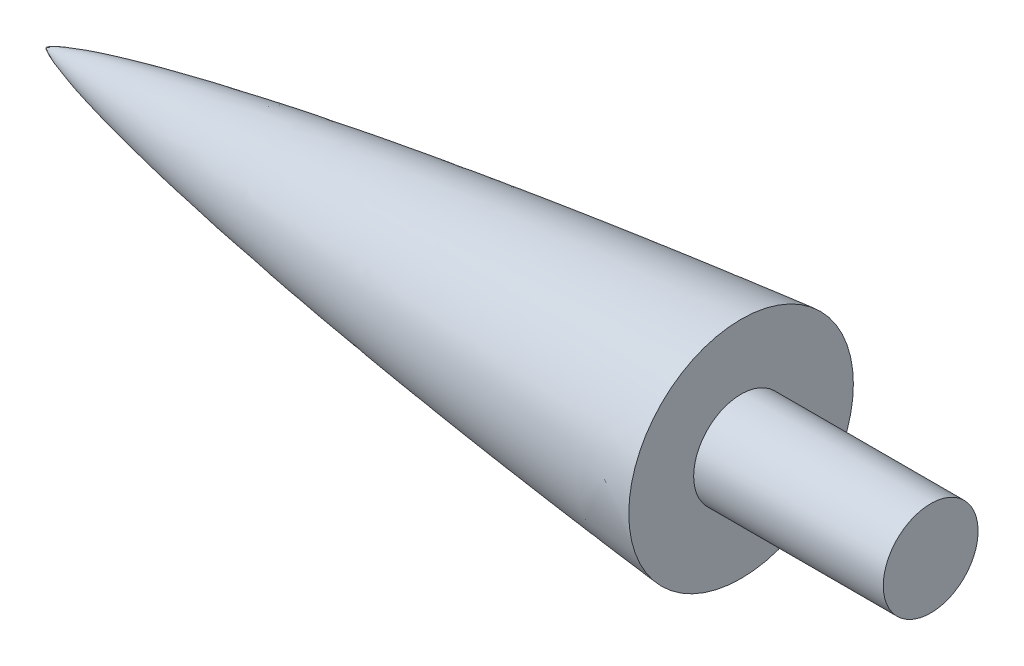
from build123d import *


with BuildPart() as part:
    # Sketch1 → Revolve1 (revolve)
    with BuildSketch(Plane(origin=(0, 0, 0), x_dir=(1, 0, 0), z_dir=(0, 1, 0)), mode=Mode.PRIVATE) as revolve1_sk:
        with BuildLine():
            Line((0, 0), (237, 0))
            Line((237, 0), (237, 12.7))
            Line((237, 12.7), (186.200000001, 12.7))
            Line((186.200000001, 12.7), (186.200000001, 30.088313688))
            add(Edge.make_bspline(
                [(0, 0), (0.003158286, 0.008829813), (0.011229963, 0.025572562), (0.034173952, 0.055394335), (0.070730621, 0.094265852), (0.115237936, 0.13487999), (0.179553821, 0.187856384), (0.267185048, 0.253150012), (0.397734037, 0.341277271), (0.610871439, 0.471010948), (0.957250279, 0.66022061), (1.547122185, 0.947112728), (2.583385336, 1.392008475), (4.426346664, 2.084223597), (7.618568962, 3.126254483), (13.126991419, 4.685853354), (21.464841311, 6.726340541), (32.249527339, 9.038765252), (44.876919941, 11.458172514), (58.254624304, 13.792618458), (69.984213357, 15.685468886), (80.05309686, 17.220485599), (90.128985738, 18.692959915), (100.2174998, 20.108027689), (110.306660177, 21.456906321), (120.416788561, 22.748698481), (128.82775593, 23.787076006), (134.748260742, 24.498780815), (139.767576372, 25.090713467), (144.890346289, 25.683106453), (149.822499028, 26.247006409), (155.957915428, 26.929045801), (162.350717259, 27.629141752), (169.646330146, 28.401245318), (175.523614971, 29.015904278), (181.666346717, 29.636473719), (184.662971425, 29.936018172), (186.200000001, 30.088313688)],
                knots=[0, 0, 0, 0, 0, 0.000179647, 0.000359294, 0.000718589, 0.001028237, 0.001337886, 0.001963562, 0.002821582, 0.004059812, 0.006140202, 0.009559921, 0.015445992, 0.02576483, 0.044031029, 0.074194495, 0.125644126, 0.19100416, 0.256364194, 0.321724227, 0.387084262, 0.41976428, 0.452444297, 0.517804332, 0.583164367, 0.615844384, 0.648524402, 0.681204419, 0.697544428, 0.713884437, 0.746564454, 0.779244471, 0.811924489, 0.844604506, 0.877284523, 0.909964541, 0.909964541, 0.909964541, 0.909964541, 0.909964541], degree=4))
        make_face()
    revolve(revolve1_sk.sketch.rotate(Axis((0, 0, 0), (1, 0, 0)), 180), axis=Axis((0, 0, 0), (1, 0, 0)))


solid = part.part
